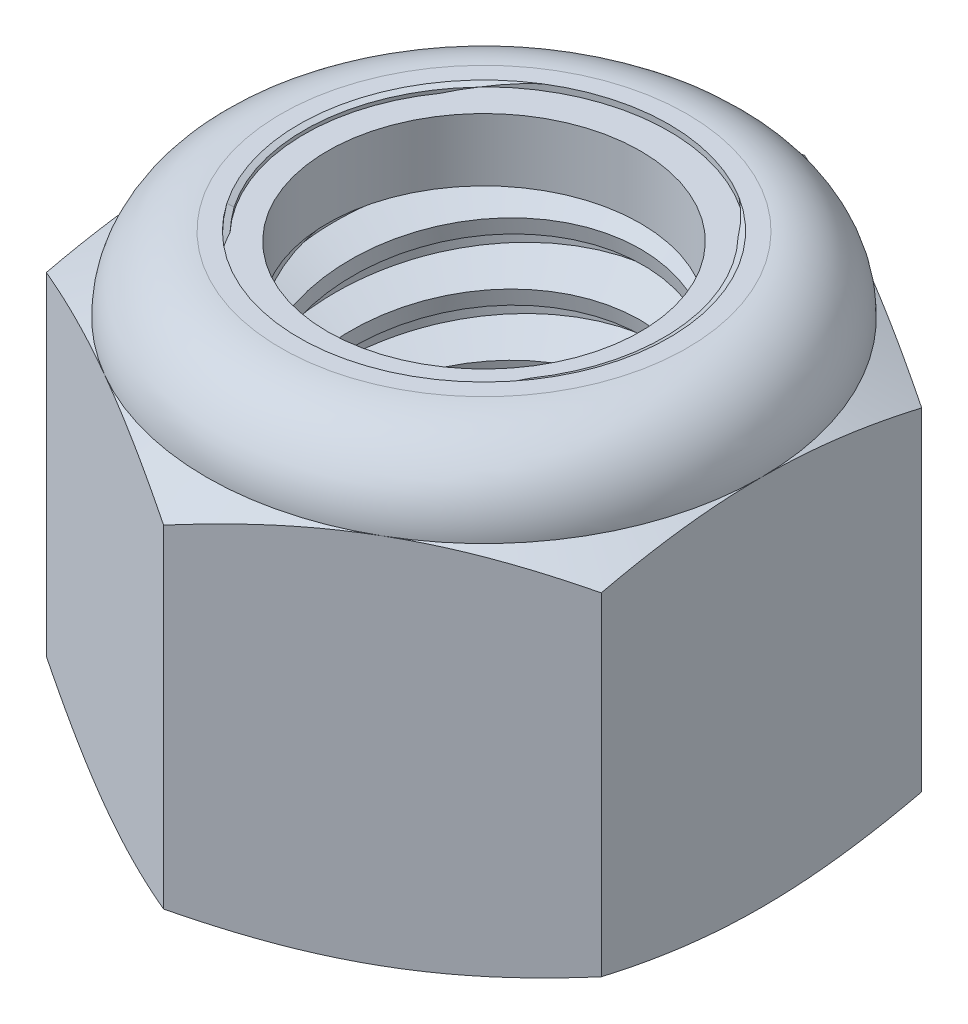
from build123d import *

# Parameters (mm, degrees)
EXTRUDE1_DEPTH      = 11.509375
SKETCH2_W           = 4.7625
SKETCH2_H           = 11.509375
LPATTERN1_COUNT     = 7
LPATTERN1_PITCH     = 1.5875
LPATTERN1_COL_COUNT = 2
LPATTERN1_COL_PITCH = 1.5875


with BuildPart() as part:
    # Sketch1 → Extrude1 (new body)
    with BuildSketch(Plane(origin=(0, 0, 0), x_dir=(1, 0, 0), z_dir=(0, 1, 0))):
        Polygon((0, 8.248891971), (-7.14375, 4.124445986), (-7.14375, -4.124445986), (0, -8.248891971), (7.14375, -4.124445986), (7.14375, 4.124445986), align=None)
    extrude(amount=EXTRUDE1_DEPTH)

    # Sketch4 → Cut-Revolve2 (revolve, cut)
    with BuildSketch(Plane(origin=(0, 0, 0), x_dir=(0, 0, -1), z_dir=(1, 0, 0)), mode=Mode.PRIVATE) as cut_revolve2_sk:
        Polygon((0, 11.509375), (4.7625, 11.509375), (4.029111805, 11.167390468), (4.029111805, 0.341984532), (4.7625, 0), (0, 0), align=None)
    revolve(cut_revolve2_sk.sketch.rotate(Axis((0, 11.509375, 0), (0, 1, 0)), 55.157981045), axis=Axis((0, 11.509375, 0), (0, 1, 0)), mode=Mode.SUBTRACT)


with BuildPart() as body_2:
    # Sketch2 → Revolve1 (revolve)
    with BuildSketch(Plane(origin=(0, 0, 0), x_dir=(0, 0, -1), z_dir=(1, 0, 0))):
        with Locations((2.38125, 5.7546875)):
            Rectangle(SKETCH2_W, SKETCH2_H)
    revolve(axis=Axis((0, -4.7625, 0), (0, 1, 0)))

    # Sketch3 → Cut-Revolve1 (revolve, cut)
    with BuildSketch(Plane(origin=(0, 0, 0), x_dir=(0, 0, -1), z_dir=(1, 0, 0)), mode=Mode.PRIVATE) as cut_revolve1_sk:
        Polygon((4.795122924, 11.313637456), (5.023483392, 9.943474646), (4.094357653, 10.291557102), (4.029111805, 10.68303219), align=None)
    cut_revolve1 = revolve(cut_revolve1_sk.sketch.rotate(Axis((0, 11.509375, 0.28317269), (0, -0.9863939238321437, -0.16439898730535765)), 180), axis=Axis((0, 11.509375, 0.28317269), (0, -0.9863939238321437, -0.16439898730535765)), mode=Mode.SUBTRACT)

    # LPattern1: Cut-Revolve1 ×7
    with Locations(*[(0, -i * LPATTERN1_PITCH, 0) for i in range(1, LPATTERN1_COUNT)]):
        add(cut_revolve1, mode=Mode.SUBTRACT)

    # LPattern1 col: Cut-Revolve1 ×2
    with Locations(*[(0, i * LPATTERN1_COL_PITCH, 0) for i in range(1, LPATTERN1_COL_COUNT)]):
        add(cut_revolve1, mode=Mode.SUBTRACT)


with BuildPart() as part_1:
    add(part.part)

    # Combine1: cut body 2
    add(body_2.part, mode=Mode.SUBTRACT)

    # Sketch5 → Cut-Revolve3 (revolve, cut)
    with BuildSketch(Plane(origin=(0, 0, 0), x_dir=(0, 0, -1), z_dir=(1, 0, 0)), mode=Mode.PRIVATE) as cut_revolve3_sk:
        with BuildLine():
            Line((0, 0), (7.14375, 0))
            Line((7.14375, 0), (8.248891971, 0.515336164))
            Line((8.248891971, 0.515336164), (8.248891971, 9.075809669))
            Line((8.248891971, 9.075809669), (7.14375, 9.591145833))
            ThreePointArc((7.14375, 9.591145833), (6.581913685, 10.947538685), (5.225520833, 11.509375))
            Line((5.225520833, 11.509375), (5.225520833, 12.779375))
            Line((5.225520833, 12.779375), (9.518891971, 12.779375))
            Line((9.518891971, 12.779375), (9.518891971, -1.27))
            Line((9.518891971, -1.27), (0, -1.27))
            Line((0, -1.27), (0, 0))
        make_face()
    revolve(cut_revolve3_sk.sketch.rotate(Axis((0, 0, 0), (0, 1, 0)), 55.157981045), axis=Axis((0, 0, 0), (0, 1, 0)), mode=Mode.SUBTRACT)

    # Sketch6 → Cut-Revolve4 (revolve, cut)
    with BuildSketch(Plane(origin=(0, 0, 0), x_dir=(0, 0, -1), z_dir=(1, 0, 0)), mode=Mode.PRIVATE) as cut_revolve4_sk:
        with BuildLine():
            Line((0, 9.591145833), (6.99135, 9.591145833))
            ThreePointArc((6.99135, 9.591145833), (6.474150612, 10.839775612), (5.225520833, 11.356975))
            Line((5.225520833, 11.356975), (4.627316319, 11.356975))
            Line((4.627316319, 11.356975), (4.627316319, 12.779375))
            Line((4.627316319, 12.779375), (0, 12.779375))
            Line((0, 12.779375), (0, 9.591145833))
        make_face()
    revolve(cut_revolve4_sk.sketch.rotate(Axis((0, 12.779375, 0), (0, 1, 0)), 55.157981045), axis=Axis((0, 12.779375, 0), (0, 1, 0)), mode=Mode.SUBTRACT)


with BuildPart() as body_2_2:
    # Sketch7 → Revolve2 (revolve)
    with BuildSketch(Plane(origin=(0, 0, 0), x_dir=(0, 0, -1), z_dir=(1, 0, 0)), mode=Mode.PRIVATE) as revolve2_sk:
        with BuildLine():
            Line((4.029111805, 9.667345833), (6.913430867, 9.667345833))
            ThreePointArc((6.913430867, 9.667345833), (6.39301751, 10.812537757), (5.225520833, 11.280775))
            Line((5.225520833, 11.280775), (4.029111805, 11.280775))
            Line((4.029111805, 11.280775), (4.029111805, 9.667345833))
        make_face()
    revolve(revolve2_sk.sketch.rotate(Axis((0, 9.667345833, 0), (0, 1, 0)), 55.157981045), axis=Axis((0, 9.667345833, 0), (0, 1, 0)))


solid = Compound([part_1.part, body_2_2.part])
